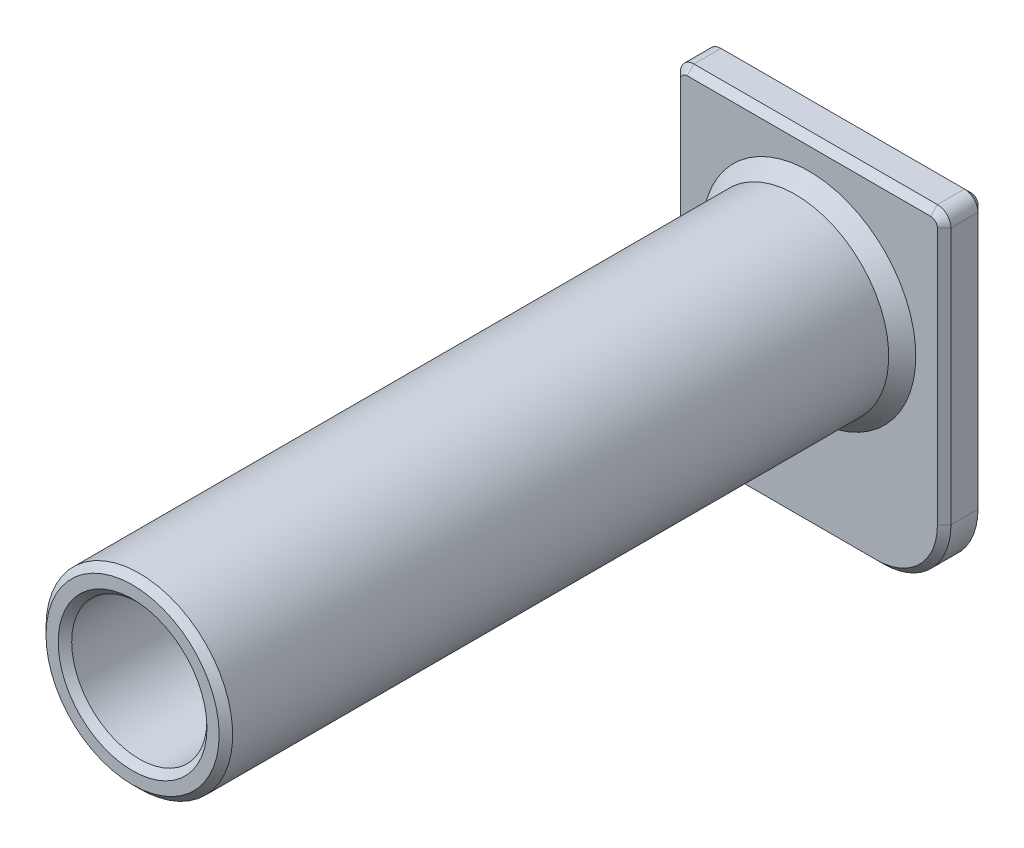
from build123d import *

# Parameters (mm, degrees)
SKETCH2_R           = 6.9
BOSS_EXTRUDE1_DEPTH = 3
SKETCH3_R           = 6.9
SKETCH3_R_2         = 5
BOSS_EXTRUDE2_DEPTH = 53
CHAMFER1_SIZE       = 0.5
CHAMFER2_SIZE       = 1


with BuildPart() as part:
    # Sketch2 → Boss-Extrude1 (new body)
    with BuildSketch(Plane.XY):
        with BuildLine():
            Line((102.765440341, 138.860814374), (120.765440341, 138.860814374))
            ThreePointArc((120.765440341, 138.860814374), (121.472547122, 138.567921155), (121.765440341, 137.860814374))
            Line((121.765440341, 137.860814374), (121.765440341, 118.860814374))
            ThreePointArc((121.765440341, 118.860814374), (120.300974247, 115.325280468), (116.765440341, 113.860814374))
            Line((116.765440341, 113.860814374), (106.765440341, 113.860814374))
            ThreePointArc((106.765440341, 113.860814374), (103.229906435, 115.325280468), (101.765440341, 118.860814374))
            Line((101.765440341, 118.860814374), (101.765440341, 137.860814374))
            ThreePointArc((101.765440341, 137.860814374), (102.058333559, 138.567921155), (102.765440341, 138.860814374))
        make_face()
        with Locations((111.765440341, 128.860814374)):
            Circle(SKETCH2_R, mode=Mode.SUBTRACT)
    extrude(amount=BOSS_EXTRUDE1_DEPTH)

    # Sketch3 → Boss-Extrude2 (add)
    with BuildSketch(Plane.XY):
        with Locations(Location((111.765440341, 128.860814374, 0), (0, 0, 180))):
            Circle(SKETCH3_R)
        with Locations(Location((111.765440341, 128.860814374, 0), (0, 0, 180))):
            Circle(SKETCH3_R_2, mode=Mode.SUBTRACT)
    extrude(amount=BOSS_EXTRUDE2_DEPTH)

    # Chamfer1
    chamfer1_edges = [part.edges().sort_by_distance(p)[0] for p in [
        (121.472547122, 138.567921155, 0),
        (121.765440341, 128.360814374, 0),
        (111.765440341, 138.860814374, 3),
        (120.300974247, 115.325280468, 0),
        (111.765440341, 113.860814374, 0),
        (103.229906435, 115.325280468, 0),
        (101.765440341, 128.360814374, 0),
        (102.058333559, 138.567921155, 0),
        (111.765440341, 138.860814374, 0),
        (102.058333559, 138.567921155, 3),
        (101.765440341, 128.360814374, 3),
        (103.229906435, 115.325280468, 3),
        (118.665440341, 128.860814374, 53),
        (116.765440341, 128.860814374, 0),
        (116.765440341, 128.860814374, 53),
        (111.765440341, 113.860814374, 3),
        (120.300974247, 115.325280468, 3),
        (121.765440341, 128.360814374, 3),
        (121.472547122, 138.567921155, 3),
    ]]
    chamfer(chamfer1_edges, length=CHAMFER1_SIZE)

    # Chamfer2
    chamfer2_edges = [part.edges().sort_by_distance(p)[0] for p in [
        (118.665440341, 128.860814374, 3),
    ]]
    chamfer(chamfer2_edges, length=CHAMFER2_SIZE)


solid = part.part
